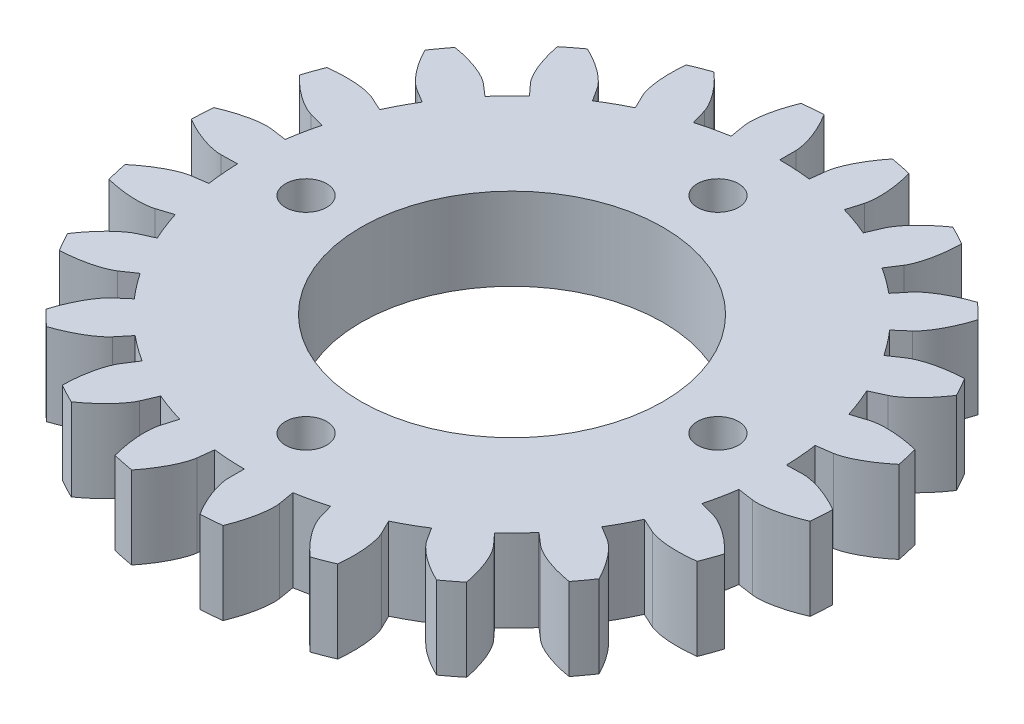
from build123d import *

# Parameters (mm, degrees)
GEAR_BILLET_R             = 24
GEAR_BILLET_EXTRUDE_DEPTH = 6
CUT_TOOTH_PROFILE_REACH   = 36.467
DUPLICATE_TEETH_COUNT     = 22
ESQUISSE1_R               = 11
ENL_V_MAT_EXTRU_5_DEPTH   = 35.439387817
ESQUISSE3_R               = 1.5
ENL_V_MAT_EXTRU_10_DEPTH  = 35.439387817


with BuildPart() as part:
    # Gear billet → Gear billet Extrude (new body)
    with BuildSketch(Plane(origin=(0, 0, 0), x_dir=(1, 0, 0), z_dir=(0, 1, 0))):
        Circle(GEAR_BILLET_R)
    extrude(amount=GEAR_BILLET_EXTRUDE_DEPTH)

    # Tooth profile → Cut tooth profile (cut, up to next)
    with BuildSketch(Plane(origin=(0, 6, 0), x_dir=(1, 0, 0), z_dir=(0, 1, 0)), mode=Mode.PRIVATE) as cut_tooth_profile_sk1:
        with BuildLine():
            Line((0, 20.673237657), (0, 19.5))
            ThreePointArc((0, 19.5), (1.144960514, 19.466357271), (2.285970301, 19.365545171))
            Line((2.285970301, 19.365545171), (2.423508067, 20.530693215))
            add(Edge.make_bspline(
                [(2.423508067, 20.530693215), (2.427244886, 20.56234959), (2.43660509, 20.625369072), (2.472717357, 20.80054269), (2.566754186, 21.128342161), (2.753755458, 21.61685837), (3.074075189, 22.260378337), (3.447629571, 22.864845224), (3.767039414, 23.31011362), (3.972007907, 23.574123406), (4.038541649, 23.657772113)],
                knots=[0, 0, 0, 0, 0, 0.002802036, 0.005604071, 0.015718253, 0.029959921, 0.048733673, 0.068727069, 0.078127195, 0.078127195, 0.078127195, 0.078127195, 0.078127195], degree=4))
            ThreePointArc((4.038541649, 23.657772113), (1.409182172, 23.958593565), (-1.237312631, 23.968084142))
            add(Edge.make_bspline(
                [(0, 20.673237657), (0, 20.705113823), (-0.001907938, 20.768796068), (-0.017235735, 20.946995256), (-0.072196484, 21.283558377), (-0.200639973, 21.790628226), (-0.4433117, 22.467261887), (-0.743429183, 23.111352402), (-1.008438179, 23.590994794), (-1.181043721, 23.877212502), (-1.237312631, 23.968084142)],
                knots=[0, 0, 0, 0, 0, 0.002802036, 0.005604071, 0.015718253, 0.029959921, 0.048733673, 0.068727069, 0.078127195, 0.078127195, 0.078127195, 0.078127195, 0.078127195], degree=4))
        make_face()
    cut_tooth_profile_tool1 = extrude(cut_tooth_profile_sk1.sketch, amount=-CUT_TOOTH_PROFILE_REACH, mode=Mode.PRIVATE) & part.part
    cut_tooth_profile = cut_tooth_profile_tool1.solids().sort_by_distance((1.296013, 6, -22.034521))[0]
    add(cut_tooth_profile, mode=Mode.SUBTRACT)

    # Duplicate teeth: Cut tooth profile ×22 about axis
    duplicate_teeth_axis = Axis((0, 6, 0), (0, -1, 0))
    for i in range(1, DUPLICATE_TEETH_COUNT):
        add(cut_tooth_profile.rotate(duplicate_teeth_axis, i * 360 / DUPLICATE_TEETH_COUNT), mode=Mode.SUBTRACT)

    # Esquisse1 → Enlèv. mat.-Extru.5 (cut, through all)
    with BuildSketch(Plane(origin=(0, 0, 0), x_dir=(1, 0, 0), z_dir=(0, 1, 0))):
        Circle(ESQUISSE1_R)
    extrude(amount=ENL_V_MAT_EXTRU_5_DEPTH, mode=Mode.SUBTRACT)

    # Esquisse3 → Enlèv. mat.-Extru.10 (cut, through all)
    with BuildSketch(Plane.XZ):
        with Locations((0, 15)):
            Circle(ESQUISSE3_R)
        with Locations((15, 0)):
            Circle(ESQUISSE3_R)
        with Locations((0, -15)):
            Circle(ESQUISSE3_R)
        with Locations((-15, 0)):
            Circle(ESQUISSE3_R)
    extrude(amount=-ENL_V_MAT_EXTRU_10_DEPTH, mode=Mode.SUBTRACT)


solid = part.part
